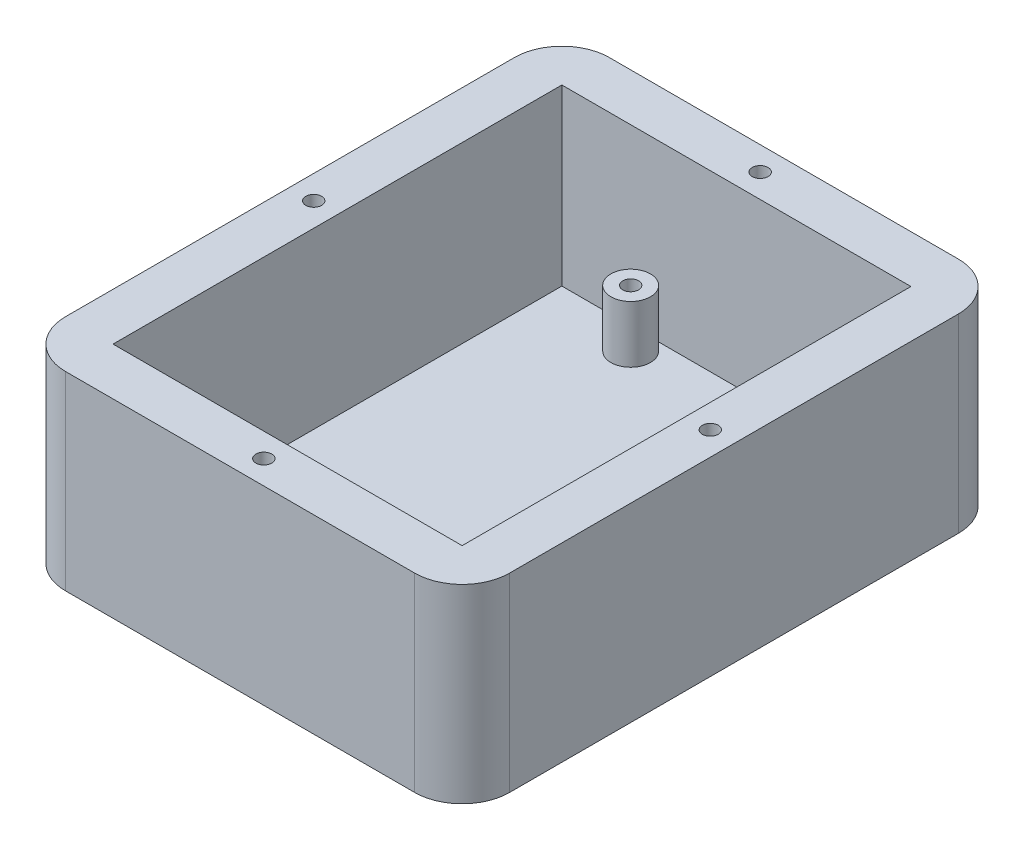
from build123d import *

# Parameters (mm, degrees)
BOSS_EXTRUDE1_DEPTH = 38.1
SKETCH2_W           = 69.999999954
SKETCH2_H           = 90.000000086
CUT_EXTRUDE1_DEPTH  = 34.925
SKETCH3_R           = 3.96875
SKETCH3_R_2         = 1.5875
BOSS_EXTRUDE2_DEPTH = 11.43
BOSS_EXTRUDE3_DEPTH = 38.1
SKETCH5_R           = 1.5875
CUT_EXTRUDE2_DEPTH  = 12.7
SKETCH7_R           = 1.5875
CUT_EXTRUDE3_DEPTH  = 3.175


with BuildPart() as part:
    # Sketch1 → Boss-Extrude1 (new body)
    with BuildSketch(Plane(origin=(0, 0, 0), x_dir=(1, 0, 0), z_dir=(0, 1, 0))):
        with BuildLine():
            Line((3.175, 0), (73.174999954, 0))
            ThreePointArc((73.174999954, 0), (75.420063984, 0.92993597), (76.349999954, 3.175))
            Line((76.349999954, 3.175), (76.349999954, 93.175000086))
            ThreePointArc((76.349999954, 93.175000086), (75.420063984, 95.420064116), (73.174999954, 96.350000086))
            Line((73.174999954, 96.350000086), (3.175, 96.350000086))
            ThreePointArc((3.175, 96.350000086), (0.92993597, 95.420064116), (0, 93.175000086))
            Line((0, 93.175000086), (0, 3.175))
            ThreePointArc((0, 3.175), (0.92993597, 0.92993597), (3.175, 0))
        make_face()
    extrude(amount=BOSS_EXTRUDE1_DEPTH)

    # Sketch2 → Cut-Extrude1 (cut)
    with BuildSketch(Plane(origin=(0, 38.1, 0), x_dir=(1, 0, 0), z_dir=(0, 1, 0))):
        with Locations((38.174999977, 48.175000043)):
            Rectangle(SKETCH2_W, SKETCH2_H)
    extrude(amount=-CUT_EXTRUDE1_DEPTH, mode=Mode.SUBTRACT)

    # Sketch3 → Boss-Extrude2 (add)
    # profile 1 of 2: a face of its own
    with BuildSketch(Plane(origin=(0, 3.175, 0), x_dir=(1, 0, 0), z_dir=(0, 1, 0))):
        with Locations(Location((21.371999977, 88.775000043, 0), (0, 0, 90))):
            Circle(SKETCH3_R)
        with Locations(Location((21.371999977, 88.775000043, 0), (0, 0, 270))):
            Circle(SKETCH3_R_2, mode=Mode.SUBTRACT)
    # profile 2 of 2: a face of its own
    with BuildSketch(Plane(origin=(0, 3.175, 0), x_dir=(1, 0, 0), z_dir=(0, 1, 0))):
        with Locations(Location((39.704999977, 8.975000043, 0), (0, 0, 90))):
            Circle(SKETCH3_R)
        with Locations(Location((39.704999977, 8.975000043, 0), (0, 0, 270))):
            Circle(SKETCH3_R_2, mode=Mode.SUBTRACT)
    extrude(amount=BOSS_EXTRUDE2_DEPTH)

    # Sketch4 → Boss-Extrude3 (add)
    with BuildSketch(Plane.XZ):
        with BuildLine():
            Line((-6.35, -3.175), (-6.35, -93.175000086))
            ThreePointArc((-6.35, -93.175000086), (-3.560192091, -99.910192177), (3.175, -102.700000086))
            Line((3.175, -102.700000086), (73.174999954, -102.700000086))
            ThreePointArc((73.174999954, -102.700000086), (79.910192045, -99.910192177), (82.699999954, -93.175000086))
            Line((82.699999954, -93.175000086), (82.699999954, -3.175))
            ThreePointArc((82.699999954, -3.175), (79.910192045, 3.560192091), (73.174999954, 6.35))
            Line((73.174999954, 6.35), (3.175, 6.35))
            ThreePointArc((3.175, 6.35), (-3.560192091, 3.560192091), (-6.35, -3.175))
        make_face()
        with BuildLine():
            Line((0, -3.175), (0, -93.175000086))
            ThreePointArc((0, -93.175000086), (0.92993597, -95.420064116), (3.175, -96.350000086))
            Line((3.175, -96.350000086), (73.174999954, -96.350000086))
            ThreePointArc((73.174999954, -96.350000086), (75.420063984, -95.420064116), (76.349999954, -93.175000086))
            Line((76.349999954, -93.175000086), (76.349999954, -3.175))
            ThreePointArc((76.349999954, -3.175), (75.420063984, -0.92993597), (73.174999954, 0))
            Line((73.174999954, 0), (3.175, 0))
            ThreePointArc((3.175, 0), (0.92993597, -0.92993597), (0, -3.175))
        make_face(mode=Mode.SUBTRACT)
    extrude(amount=-BOSS_EXTRUDE3_DEPTH)

    # Sketch5 → Cut-Extrude2 (cut)
    with BuildSketch(Plane(origin=(0, 38.1, 0), x_dir=(1, 0, 0), z_dir=(0, 1, 0))):
        with Locations(Location((-1.5875, 48.175000043, 0), (0, 0, 270))):
            Circle(SKETCH5_R)
        with Locations(Location((38.174999977, 97.937500086, 0), (0, 0, 270))):
            Circle(SKETCH5_R)
        with Locations(Location((38.174999977, -1.5875, 0), (0, 0, 90))):
            Circle(SKETCH5_R)
        with Locations(Location((77.937499954, 48.175000043, 0), (0, 0, 90))):
            Circle(SKETCH5_R)
    extrude(amount=-CUT_EXTRUDE2_DEPTH, mode=Mode.SUBTRACT)

    # Sketch7 → Cut-Extrude3 (cut)
    with BuildSketch(Plane(origin=(0, 3.175, 0), x_dir=(1, 0, 0), z_dir=(0, 1, 0))):
        with Locations(Location((68.174999954, 70.175000043, 0), (0, 0, 270))):
            Circle(SKETCH7_R)
        with Locations(Location((68.174999954, 26.175000043, 0), (0, 0, 270))):
            Circle(SKETCH7_R)
    extrude(amount=-CUT_EXTRUDE3_DEPTH, mode=Mode.SUBTRACT)


solid = part.part
